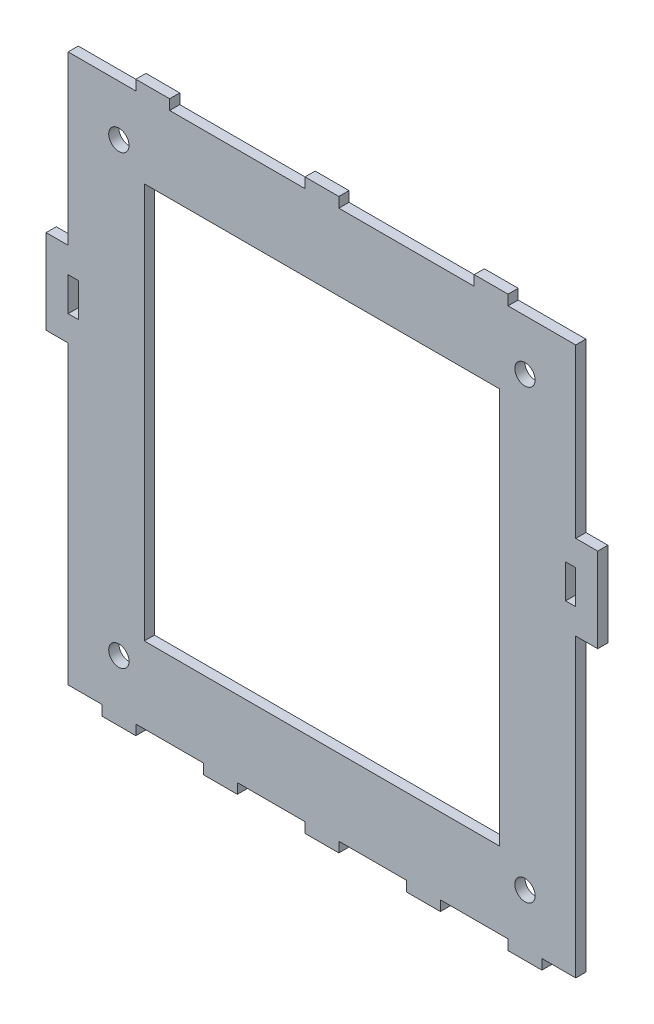
from build123d import *

# Parameters (mm, degrees)
SKETCH1_W                = 3
SKETCH1_H                = 10
BOSS_EXTRUDE2_DEPTH      = 3
F_6_0_6_DIAMETER_HOLE1_D = 6
SKETCH5_W                = 105
SKETCH5_H                = 117
CUT_EXTRUDE1_DEPTH       = 10


with BuildPart() as part:
    # Sketch1 → Boss-Extrude2 (new body)
    with BuildSketch(Plane.XY):
        Polygon((-5, 65), (5, 65), (5, 62), (45, 62), (45, 65), (55, 65), (55, 62), (75, 62), (75, 12.5), (81.5, 12.5), (81.5, -12.5), (75, -12.5), (75, -100), (65, -100), (65, -103), (55, -103), (55, -100), (35, -100), (35, -103), (25, -103), (25, -100), (5, -100), (5, -103), (-5, -103), (-5, -100), (-25, -100), (-25, -103), (-35, -103), (-35, -100), (-55, -100), (-55, -103), (-65, -103), (-65, -100), (-75, -100), (-75, -12.5), (-81.5, -12.5), (-81.5, 12.5), (-75, 12.5), (-75, 62), (-55, 62), (-55, 65), (-45, 65), (-45, 62), (-5, 62), align=None)
        with Locations((-73.5, 0)):
            Rectangle(SKETCH1_W, SKETCH1_H, mode=Mode.SUBTRACT)
        with Locations((73.5, 0)):
            Rectangle(SKETCH1_W, SKETCH1_H, mode=Mode.SUBTRACT)
    extrude(amount=BOSS_EXTRUDE2_DEPTH)

    # Ø6.0 (6) Diameter Hole1 (through all)
    with Locations(Plane.XY.offset(3)):
        with Locations((-60, 47), (60, 47), (-60, -85), (60, -85)):
            Hole(F_6_0_6_DIAMETER_HOLE1_D / 2)

    # Sketch5 → Cut-Extrude1 (cut)
    with BuildSketch(Plane.XY.offset(3)):
        with Locations((0, -19)):
            Rectangle(SKETCH5_W, SKETCH5_H)
    extrude(amount=-CUT_EXTRUDE1_DEPTH, mode=Mode.SUBTRACT)


solid = part.part
